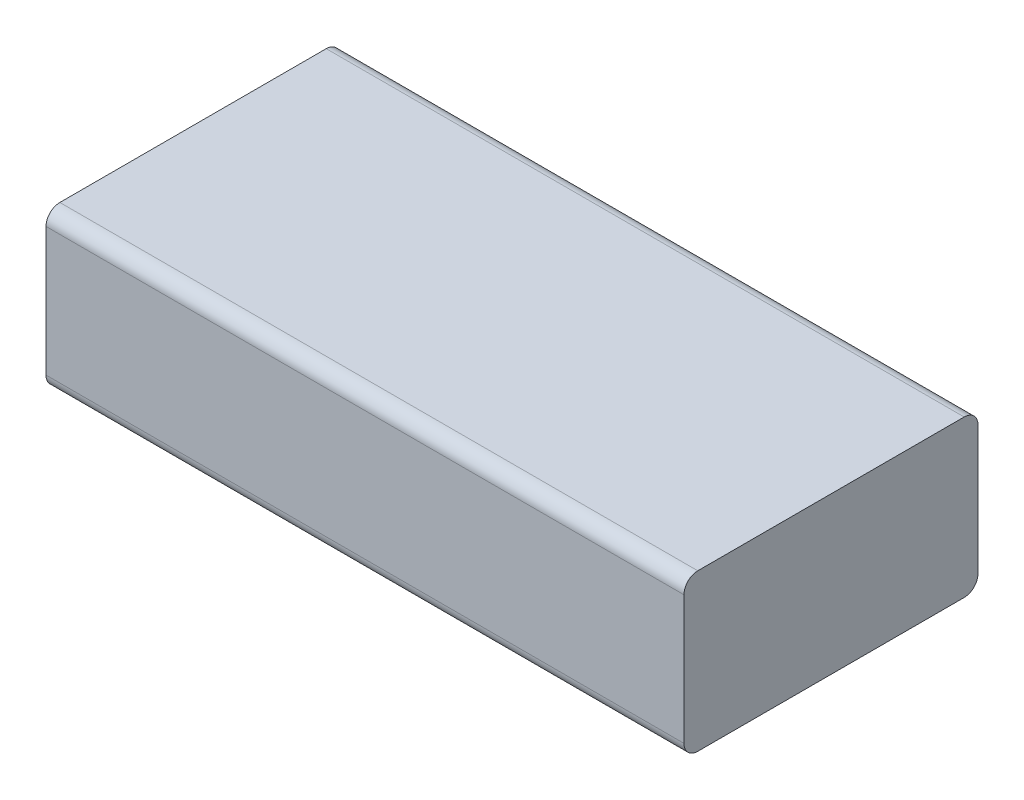
from build123d import *

# Parameters (mm, degrees)
SKETCH_1_W      = 92.2
SKETCH_1_H      = 42.5
EXTRUDE_1_DEPTH = 22.6
FILLET_1_R      = 2
SKETCH_6_R      = 1.5
SKETCH_6_W      = 15
SKETCH_6_H      = 6
EXTRUDE_5_DEPTH = 3


with BuildPart() as part:
    # 草图1 → 凸台-拉伸1 (new body)
    with BuildSketch(Plane(origin=(0, 0, 0), x_dir=(1, 0, 0), z_dir=(0, 1, 0))):
        Rectangle(SKETCH_1_W, SKETCH_1_H)
    extrude(amount=EXTRUDE_1_DEPTH)

    # 圆角1
    fillet_1_edges = [part.edges().sort_by_distance(p)[0] for p in [
        (0, 22.6, 21.25),
        (0, 0, 21.25),
        (0, 0, -21.25),
        (0, 22.6, -21.25),
    ]]
    fillet(fillet_1_edges, radius=FILLET_1_R)

    # 草图6 → 凸台-拉伸5 (add)
    with BuildSketch(Plane.ZY.offset(46.1)):
        with Locations(Location((-16, 4, 0), (0, 0, 180))):
            Circle(SKETCH_6_R)
        with Locations((7.5, 14.6)):
            Rectangle(SKETCH_6_W, SKETCH_6_H)
    extrude(amount=EXTRUDE_5_DEPTH)


solid = part.part
